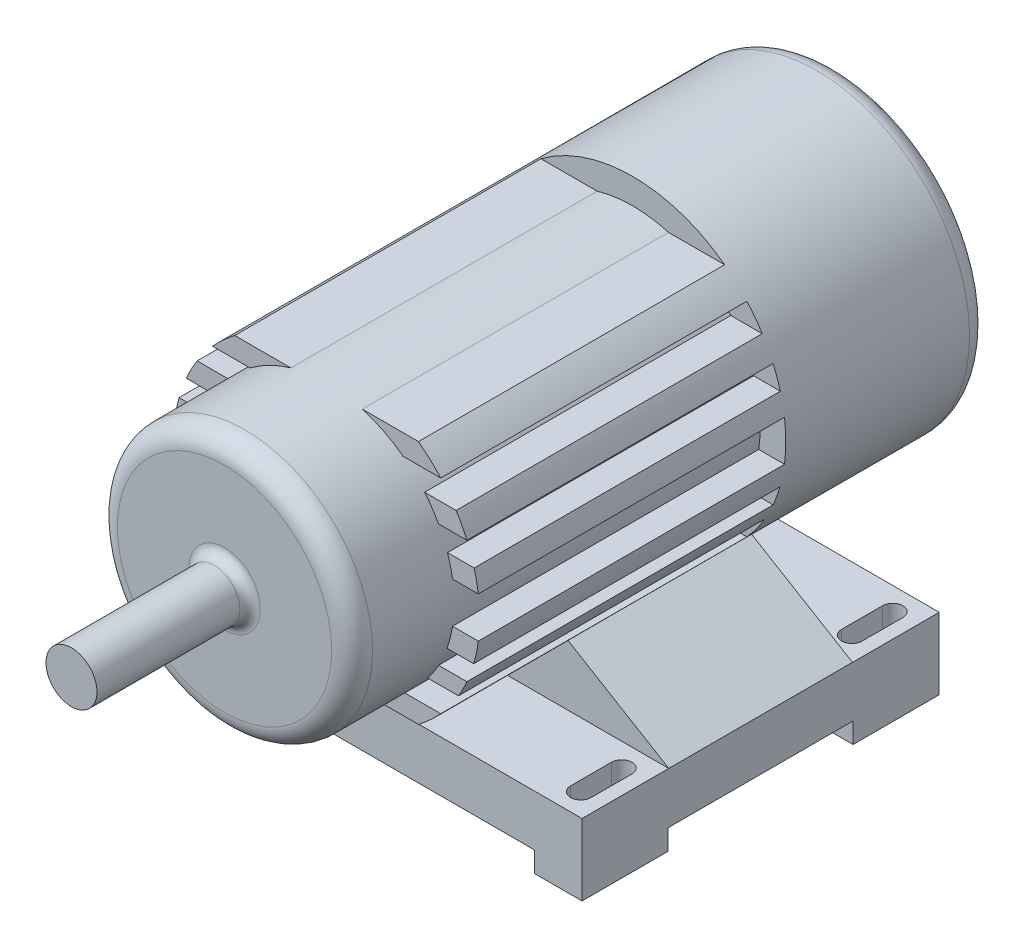
from build123d import *
from build123d.topology import SkipClean

# Parameters (mm, degrees)
SKETCH1_R            = 150
BOSS_EXTRUDE1_DEPTH  = 200
BOSS_EXTRUDE11_DEPTH = 300
BOSS_EXTRUDE14_START = -300
SKETCH12_R           = 125
BOSS_EXTRUDE14_DEPTH = 400
SKETCH13_W           = 46.677917496
SKETCH13_H           = 84.453402707
SKETCH13_H_2         = 84.453402706
SKETCH13_W_2         = 50
BOSS_EXTRUDE15_DEPTH = 50
SKETCH13_3_W         = 46.677917496
SKETCH13_3_H         = 84.453402706
SKETCH13_3_H_2       = 84.453402707
SKETCH13_3_W_2       = 50
BOSS_EXTRUDE16_DEPTH = 20
BOSS_EXTRUDE17_DEPTH = 90
SKETCH16_R           = 25
BOSS_EXTRUDE18_DEPTH = 150
FILLET2_R            = 10
FILLET3_R            = 20
SCALE4_SCALE         = 0.22917


with BuildPart() as part:
    # Sketch1 → Boss-Extrude1 (new body)
    with BuildSketch(Plane.XY):
        Circle(SKETCH1_R)
    extrude(amount=BOSS_EXTRUDE1_DEPTH)

    # Sketch7 → Boss-Extrude11 (add)
    with SkipClean():  # the faces are left unmerged after this step: merging them gives an invalid solid
        with BuildSketch(Plane.XY.offset(200)):
            with BuildLine():
                Line((-90, 120), (90, 120))
                ThreePointArc((90, 120), (101.396020382, 110.538893837), (111.803398875, 100))
                Line((111.803398875, 100), (-111.803398875, 100))
                ThreePointArc((-111.803398875, 100), (-101.396020382, 110.538893837), (-90, 120))
            make_face()
            with BuildLine():
                Line((-126.885775404, 80), (126.885775404, 80))
                ThreePointArc((126.885775404, 80), (132.559251115, 70.200035213), (137.477270849, 60))
                Line((137.477270849, 60), (-137.477270849, 60))
                ThreePointArc((-137.477270849, 60), (-132.559251115, 70.200035213), (-126.885775404, 80))
            make_face()
            with BuildLine():
                Line((144.16342013, -41.435592144), (-144.16342013, -41.435592144))
                ThreePointArc((-144.16342013, -41.435592144), (-146.803816882, -30.799989431), (-148.660687473, -20))
                Line((-148.660687473, -20), (148.660687473, -20))
                ThreePointArc((148.660687473, -20), (146.803816882, -30.799989431), (144.16342013, -41.435592144))
            make_face()
            with BuildLine():
                Line((111.803398875, -100), (-111.803398875, -100))
                ThreePointArc((-111.803398875, -100), (-101.396020382, -110.538893837), (-90, -120))
                Line((-90, -120), (90, -120))
                ThreePointArc((90, -120), (101.396020382, -110.538893837), (111.803398875, -100))
            make_face()
            with BuildLine():
                Line((144.568322948, 40), (-144.568322948, 40))
                ThreePointArc((-144.568322948, 40), (-146.955139883, 30.069700063), (-148.660687473, 20))
                Line((-148.660687473, 20), (148.660687473, 20))
                ThreePointArc((148.660687473, 20), (146.955139883, 30.069700063), (144.568322948, 40))
            make_face()
            with BuildLine():
                Line((137.477270849, -60), (-137.477270849, -60))
                ThreePointArc((-137.477270849, -60), (-133.599215205, -68.20007109), (-129.232599216, -76.150740639))
                Line((-129.232599216, -76.150740639), (129.232599216, -76.150740639))
                ThreePointArc((129.232599216, -76.150740639), (133.599215205, -68.20007109), (137.477270849, -60))
            make_face()
        extrude(amount=BOSS_EXTRUDE11_DEPTH)



with BuildPart() as body_2:
    # Sketch12 → Boss-Extrude14 (new body)
    with BuildSketch(Plane.XY.offset(500).offset(BOSS_EXTRUDE14_START)):
        Circle(SKETCH12_R)
    extrude(amount=BOSS_EXTRUDE14_DEPTH)


with BuildPart() as body_3:
    # Sketch13 → Boss-Extrude15 (new body)
    # profile 1 of 5: a face of its own
    with BuildSketch(Plane(origin=(0, -220, 0), x_dir=(-1, 0, 0), z_dir=(0, -1, 0))):
        Polygon((150, -99.735715433), (-153.322082504, -99.735715433), (-153.322082504, -184.18911814), (-200, -184.18911814), (-200, -365.282312727), (-153.322082504, -365.282312727), (-153.322082504, -449.735715433), (150, -449.735715433), (150, -365.282312727), (200, -365.282312727), (200, -184.18911814), (150, -184.18911814), align=None)
    # profile 2 of 5: a face of its own
    with BuildSketch(Plane(origin=(0, -220, 0), x_dir=(-1, 0, 0), z_dir=(0, -1, 0))):
        with Locations((-176.661041252, -141.962416787)):
            Rectangle(SKETCH13_W, SKETCH13_H)
        with BuildLine():
            ThreePointArc((-186.661041252, -121.962416787), (-176.661041252, -111.962416787), (-166.661041252, -121.962416787))
            Line((-166.661041252, -121.962416787), (-166.661041252, -161.962416787))
            ThreePointArc((-166.661041252, -161.962416787), (-176.661041252, -171.962416787), (-186.661041252, -161.962416787))
            Line((-186.661041252, -161.962416787), (-186.661041252, -121.962416787))
        make_face(mode=Mode.SUBTRACT)
    # profile 3 of 5: a face of its own
    with BuildSketch(Plane(origin=(0, -220, 0), x_dir=(-1, 0, 0), z_dir=(0, -1, 0))):
        with Locations((-176.661041252, -407.50901408)):
            Rectangle(SKETCH13_W, SKETCH13_H_2)
        with BuildLine():
            Line((-166.661041252, -387.50901408), (-166.661041252, -427.50901408))
            ThreePointArc((-166.661041252, -427.50901408), (-176.661041252, -437.50901408), (-186.661041252, -427.50901408))
            Line((-186.661041252, -427.50901408), (-186.661041252, -387.50901408))
            ThreePointArc((-186.661041252, -387.50901408), (-176.661041252, -377.50901408), (-166.661041252, -387.50901408))
        make_face(mode=Mode.SUBTRACT)
    # profile 4 of 5: a face of its own
    with BuildSketch(Plane(origin=(0, -220, 0), x_dir=(-1, 0, 0), z_dir=(0, -1, 0))):
        with Locations((175, -407.50901408)):
            Rectangle(SKETCH13_W_2, SKETCH13_H_2)
        with BuildLine():
            Line((185, -387.50901408), (185, -427.50901408))
            ThreePointArc((185, -427.50901408), (175, -437.50901408), (165, -427.50901408))
            Line((165, -427.50901408), (165, -387.50901408))
            ThreePointArc((165, -387.50901408), (175, -377.50901408), (185, -387.50901408))
        make_face(mode=Mode.SUBTRACT)
    # profile 5 of 5: a face of its own
    with BuildSketch(Plane(origin=(0, -220, 0), x_dir=(-1, 0, 0), z_dir=(0, -1, 0))):
        with Locations((175, -141.962416787)):
            Rectangle(SKETCH13_W_2, SKETCH13_H)
        with BuildLine():
            ThreePointArc((165, -121.962416787), (175, -111.962416787), (185, -121.962416787))
            Line((185, -121.962416787), (185, -161.962416787))
            ThreePointArc((185, -161.962416787), (175, -171.962416787), (165, -161.962416787))
            Line((165, -161.962416787), (165, -121.962416787))
        make_face(mode=Mode.SUBTRACT)
    extrude(amount=-BOSS_EXTRUDE15_DEPTH)

    # Sketch13<3> → Boss-Extrude16 (add)
    # profile 1 of 4: a face of its own
    with BuildSketch(Plane(origin=(0, -220, 0), x_dir=(-1, 0, 0), z_dir=(0, -1, 0))):
        with Locations((-176.661041252, -407.50901408)):
            Rectangle(SKETCH13_3_W, SKETCH13_3_H)
        with BuildLine():
            Line((-166.661041252, -387.50901408), (-166.661041252, -427.50901408))
            ThreePointArc((-166.661041252, -427.50901408), (-176.661041252, -437.50901408), (-186.661041252, -427.50901408))
            Line((-186.661041252, -427.50901408), (-186.661041252, -387.50901408))
            ThreePointArc((-186.661041252, -387.50901408), (-176.661041252, -377.50901408), (-166.661041252, -387.50901408))
        make_face(mode=Mode.SUBTRACT)
    # profile 2 of 4: a face of its own
    with BuildSketch(Plane(origin=(0, -220, 0), x_dir=(-1, 0, 0), z_dir=(0, -1, 0))):
        with Locations((-176.661041252, -141.962416787)):
            Rectangle(SKETCH13_3_W, SKETCH13_3_H_2)
        with BuildLine():
            ThreePointArc((-186.661041252, -121.962416787), (-176.661041252, -111.962416787), (-166.661041252, -121.962416787))
            Line((-166.661041252, -121.962416787), (-166.661041252, -161.962416787))
            ThreePointArc((-166.661041252, -161.962416787), (-176.661041252, -171.962416787), (-186.661041252, -161.962416787))
            Line((-186.661041252, -161.962416787), (-186.661041252, -121.962416787))
        make_face(mode=Mode.SUBTRACT)
    # profile 3 of 4: a face of its own
    with BuildSketch(Plane(origin=(0, -220, 0), x_dir=(-1, 0, 0), z_dir=(0, -1, 0))):
        with Locations((175, -407.50901408)):
            Rectangle(SKETCH13_3_W_2, SKETCH13_3_H)
        with BuildLine():
            Line((185, -387.50901408), (185, -427.50901408))
            ThreePointArc((185, -427.50901408), (175, -437.50901408), (165, -427.50901408))
            Line((165, -427.50901408), (165, -387.50901408))
            ThreePointArc((165, -387.50901408), (175, -377.50901408), (185, -387.50901408))
        make_face(mode=Mode.SUBTRACT)
    # profile 4 of 4: a face of its own
    with BuildSketch(Plane(origin=(0, -220, 0), x_dir=(-1, 0, 0), z_dir=(0, -1, 0))):
        with Locations((175, -141.962416787)):
            Rectangle(SKETCH13_3_W_2, SKETCH13_3_H_2)
        with BuildLine():
            ThreePointArc((165, -121.962416787), (175, -111.962416787), (185, -121.962416787))
            Line((185, -121.962416787), (185, -161.962416787))
            ThreePointArc((185, -161.962416787), (175, -171.962416787), (165, -161.962416787))
            Line((165, -161.962416787), (165, -121.962416787))
        make_face(mode=Mode.SUBTRACT)
    extrude(amount=BOSS_EXTRUDE16_DEPTH)


with BuildPart() as part_1:
    with SkipClean():  # the faces are left unmerged after this step: merging them gives an invalid solid
        add(part.part)

        add(body_2.part)  # Boss-Extrude17 merges body 2

        add(body_3.part)  # Boss-Extrude17 merges body 3
        # Sketch14 → Boss-Extrude17 (add, symmetric)
        with BuildSketch(Plane.XY.offset(274.735715433)):
            Polygon((-200, -170), (200, -170), (100, -110), (-100, -110), align=None)
        extrude(amount=BOSS_EXTRUDE17_DEPTH, both=True)

    # Sketch16 → Boss-Extrude18 (add)
    with BuildSketch(Plane.XY.offset(600)):
        Circle(SKETCH16_R)
    extrude(amount=BOSS_EXTRUDE18_DEPTH)

    # Fillet2
    fillet2_edges = [part_1.edges().sort_by_distance(p)[0] for p in [
        (-25, 0, 600),
    ]]
    fillet(fillet2_edges, radius=FILLET2_R)

    # Fillet3
    fillet3_edges = [part_1.edges().sort_by_distance(p)[0] for p in [
        (-125, 0, 600),
        (-150, 0, 0),
    ]]
    fillet(fillet3_edges, radius=FILLET3_R)


with BuildPart() as part_2:
    # Scale4: scaled about (-0.042581341, -38.738063296, 280.973660068)
    add(part_1.part.scale(SCALE4_SCALE).moved(Location((-0.032822975, -29.86046133, 216.58292639))))


solid = part_2.part
